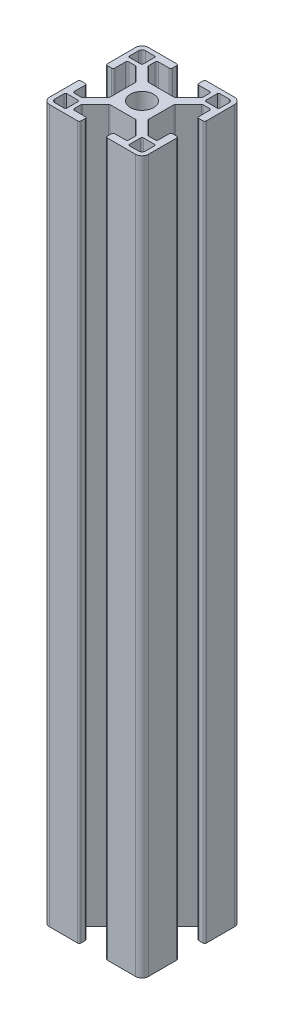
from build123d import *

# Parameters (mm, degrees)
SKETCH1_R           = 3.52998588
BOSS_EXTRUDE1_DEPTH = 107.95


with BuildPart() as part:
    # Sketch1 → Boss-Extrude1 (new, symmetric)
    with BuildSketch(Plane(origin=(0, 0, 0), x_dir=(1, 0, 0), z_dir=(0, 1, 0))):
        with BuildLine():
            Line((14.49994, -4), (13.24247465, -4))
            ThreePointArc((13.24247465, -4), (12.88892126, -4.146446609), (12.74247465, -4.5))
            Line((12.74247465, -4.5), (12.74247465, -7.732519321))
            ThreePointArc((12.74247465, -7.732519321), (12.602449697, -8.097296796), (12.242781236, -8.249967))
            Line((12.242781236, -8.249967), (10.260188032, -8.249967))
            ThreePointArc((10.260188032, -8.249967), (10.068847082, -8.211906919), (9.906636056, -8.103520976))
            Line((9.906636056, -8.103520976), (5.981117769, -4.178002689))
            ThreePointArc((5.981117769, -4.178002689), (5.872731827, -4.015791664), (5.834671745, -3.824450713))
            Line((5.834671745, -3.824450713), (5.834671745, -1.01249595))
            Line((5.834671745, -1.01249595), (5.834671745, 0.88749645))
            Line((5.834671745, 0.88749645), (5.834671745, 3.824450713))
            ThreePointArc((5.834671745, 3.824450713), (5.872731827, 4.015791664), (5.981117769, 4.178002689))
            Line((5.981117769, 4.178002689), (9.906636056, 8.103520976))
            ThreePointArc((9.906636056, 8.103520976), (10.068847082, 8.211906919), (10.260188032, 8.249967))
            Line((10.260188032, 8.249967), (12.242781236, 8.249967))
            ThreePointArc((12.242781236, 8.249967), (12.602449697, 8.097296796), (12.74247465, 7.732519321))
            Line((12.74247465, 7.732519321), (12.74247465, 4.5))
            ThreePointArc((12.74247465, 4.5), (12.88892126, 4.146446609), (13.24247465, 4))
            Line((13.24247465, 4), (14.49994, 4))
            ThreePointArc((14.49994, 4), (14.853493391, 4.146446609), (14.99994, 4.5))
            Line((14.99994, 4.5), (14.99994, 12.999948))
            ThreePointArc((14.99994, 12.999948), (14.414155906, 14.414155906), (12.999948, 14.99994))
            Line((12.999948, 14.99994), (4.5, 14.99994))
            ThreePointArc((4.5, 14.99994), (4.146446609, 14.853493391), (4, 14.49994))
            Line((4, 14.49994), (4, 13.24247465))
            ThreePointArc((4, 13.24247465), (4.146446609, 12.88892126), (4.5, 12.74247465))
            Line((4.5, 12.74247465), (7.732519321, 12.74247465))
            ThreePointArc((7.732519321, 12.74247465), (8.097296796, 12.602449697), (8.249967, 12.242781236))
            Line((8.249967, 12.242781236), (8.249967, 10.260188032))
            ThreePointArc((8.249967, 10.260188032), (8.211906919, 10.068847082), (8.103520976, 9.906636056))
            Line((8.103520976, 9.906636056), (4.178002689, 5.981117769))
            ThreePointArc((4.178002689, 5.981117769), (4.015791664, 5.872731827), (3.824450713, 5.834671745))
            Line((3.824450713, 5.834671745), (0.9499962, 5.834671745))
            Line((0.9499962, 5.834671745), (-0.9499962, 5.834671745))
            Line((-0.9499962, 5.834671745), (-3.824450713, 5.834671745))
            ThreePointArc((-3.824450713, 5.834671745), (-4.015791664, 5.872731827), (-4.178002689, 5.981117769))
            Line((-4.178002689, 5.981117769), (-8.103520976, 9.906636056))
            ThreePointArc((-8.103520976, 9.906636056), (-8.211906919, 10.068847082), (-8.249967, 10.260188032))
            Line((-8.249967, 10.260188032), (-8.249967, 12.242781236))
            ThreePointArc((-8.249967, 12.242781236), (-8.097296796, 12.602449697), (-7.732519321, 12.74247465))
            Line((-7.732519321, 12.74247465), (-4.5, 12.74247465))
            ThreePointArc((-4.5, 12.74247465), (-4.146446609, 12.88892126), (-4, 13.24247465))
            Line((-4, 13.24247465), (-4, 14.49994))
            ThreePointArc((-4, 14.49994), (-4.146446609, 14.853493391), (-4.5, 14.99994))
            Line((-4.5, 14.99994), (-12.999948, 14.99994))
            ThreePointArc((-12.999948, 14.99994), (-14.414155906, 14.414155906), (-14.99994, 12.999948))
            Line((-14.99994, 12.999948), (-14.99994, 4.5))
            ThreePointArc((-14.99994, 4.5), (-14.853493391, 4.146446609), (-14.49994, 4))
            Line((-14.49994, 4), (-13.24247465, 4))
            ThreePointArc((-13.24247465, 4), (-12.88892126, 4.146446609), (-12.74247465, 4.5))
            Line((-12.74247465, 4.5), (-12.74247465, 7.732519321))
            ThreePointArc((-12.74247465, 7.732519321), (-12.602449697, 8.097296796), (-12.242781236, 8.249967))
            Line((-12.242781236, 8.249967), (-10.260188032, 8.249967))
            ThreePointArc((-10.260188032, 8.249967), (-10.068847082, 8.211906919), (-9.906636056, 8.103520976))
            Line((-9.906636056, 8.103520976), (-5.981117769, 4.178002689))
            ThreePointArc((-5.981117769, 4.178002689), (-5.872731827, 4.015791664), (-5.834671745, 3.824450713))
            Line((-5.834671745, 3.824450713), (-5.834671745, 0.88749645))
            Line((-5.834671745, 0.88749645), (-5.834671745, -1.01249595))
            Line((-5.834671745, -1.01249595), (-5.834671745, -3.824450713))
            ThreePointArc((-5.834671745, -3.824450713), (-5.872731827, -4.015791664), (-5.981117769, -4.178002689))
            Line((-5.981117769, -4.178002689), (-9.906636056, -8.103520976))
            ThreePointArc((-9.906636056, -8.103520976), (-10.068847082, -8.211906919), (-10.260188032, -8.249967))
            Line((-10.260188032, -8.249967), (-12.242781236, -8.249967))
            ThreePointArc((-12.242781236, -8.249967), (-12.602449697, -8.097296796), (-12.74247465, -7.732519321))
            Line((-12.74247465, -7.732519321), (-12.74247465, -4.5))
            ThreePointArc((-12.74247465, -4.5), (-12.88892126, -4.146446609), (-13.24247465, -4))
            Line((-13.24247465, -4), (-14.49994, -4))
            ThreePointArc((-14.49994, -4), (-14.853493391, -4.146446609), (-14.99994, -4.5))
            Line((-14.99994, -4.5), (-14.99994, -12.999948))
            ThreePointArc((-14.99994, -12.999948), (-14.414155906, -14.414155906), (-12.999948, -14.99994))
            Line((-12.999948, -14.99994), (-4.5, -14.99994))
            ThreePointArc((-4.5, -14.99994), (-4.146446609, -14.853493391), (-4, -14.49994))
            Line((-4, -14.49994), (-4, -13.24247465))
            ThreePointArc((-4, -13.24247465), (-4.146446609, -12.88892126), (-4.5, -12.74247465))
            Line((-4.5, -12.74247465), (-7.732519321, -12.74247465))
            ThreePointArc((-7.732519321, -12.74247465), (-8.097296796, -12.602449697), (-8.249967, -12.242781236))
            Line((-8.249967, -12.242781236), (-8.249967, -10.260188032))
            ThreePointArc((-8.249967, -10.260188032), (-8.211906919, -10.068847082), (-8.103520976, -9.906636056))
            Line((-8.103520976, -9.906636056), (-4.178002689, -5.981117769))
            ThreePointArc((-4.178002689, -5.981117769), (-4.015791664, -5.872731827), (-3.824450713, -5.834671745))
            Line((-3.824450713, -5.834671745), (-0.9499962, -5.834671745))
            Line((-0.9499962, -5.834671745), (0.9499962, -5.834671745))
            Line((0.9499962, -5.834671745), (3.824450713, -5.834671745))
            ThreePointArc((3.824450713, -5.834671745), (4.015791664, -5.872731827), (4.178002689, -5.981117769))
            Line((4.178002689, -5.981117769), (8.103520976, -9.906636056))
            ThreePointArc((8.103520976, -9.906636056), (8.211906919, -10.068847082), (8.249967, -10.260188032))
            Line((8.249967, -10.260188032), (8.249967, -12.242781236))
            ThreePointArc((8.249967, -12.242781236), (8.097296796, -12.602449697), (7.732519321, -12.74247465))
            Line((7.732519321, -12.74247465), (4.5, -12.74247465))
            ThreePointArc((4.5, -12.74247465), (4.146446609, -12.88892126), (4, -13.24247465))
            Line((4, -13.24247465), (4, -14.49994))
            ThreePointArc((4, -14.49994), (4.146446609, -14.853493391), (4.5, -14.99994))
            Line((4.5, -14.99994), (12.999948, -14.99994))
            ThreePointArc((12.999948, -14.99994), (14.414155906, -14.414155906), (14.99994, -12.999948))
            Line((14.99994, -12.999948), (14.99994, -4.5))
            ThreePointArc((14.99994, -4.5), (14.853493391, -4.146446609), (14.49994, -4))
        make_face()
        with Locations(Location((0, 0, 0), (0, 0, 270))):
            Circle(SKETCH1_R, mode=Mode.SUBTRACT)
        with BuildLine():
            Line((-12.6999492, -13.6999452), (-9.880960476, -13.6999452))
            ThreePointArc((-9.880960476, -13.6999452), (-9.61155387, -13.58835333), (-9.499962, -13.318946724))
            Line((-9.499962, -13.318946724), (-9.499962, -9.87996048))
            ThreePointArc((-9.499962, -9.87996048), (-9.611260978, -9.611260978), (-9.87996048, -9.499962))
            Line((-9.87996048, -9.499962), (-13.318946724, -9.499962))
            ThreePointArc((-13.318946724, -9.499962), (-13.58835333, -9.61155387), (-13.6999452, -9.880960476))
            Line((-13.6999452, -9.880960476), (-13.6999452, -12.6999492))
            ThreePointArc((-13.6999452, -12.6999492), (-13.407053153, -13.407053153), (-12.6999492, -13.6999452))
        make_face(mode=Mode.SUBTRACT)
        with BuildLine():
            Line((13.6999452, -12.6999492), (13.6999452, -9.880960476))
            ThreePointArc((13.6999452, -9.880960476), (13.58835333, -9.61155387), (13.318946724, -9.499962))
            Line((13.318946724, -9.499962), (9.87996048, -9.499962))
            ThreePointArc((9.87996048, -9.499962), (9.611260978, -9.611260978), (9.499962, -9.87996048))
            Line((9.499962, -9.87996048), (9.499962, -13.318946724))
            ThreePointArc((9.499962, -13.318946724), (9.61155387, -13.58835333), (9.880960476, -13.6999452))
            Line((9.880960476, -13.6999452), (12.6999492, -13.6999452))
            ThreePointArc((12.6999492, -13.6999452), (13.407053153, -13.407053153), (13.6999452, -12.6999492))
        make_face(mode=Mode.SUBTRACT)
        with BuildLine():
            Line((9.87996048, 9.499962), (13.318946724, 9.499962))
            ThreePointArc((13.318946724, 9.499962), (13.58835333, 9.61155387), (13.6999452, 9.880960476))
            Line((13.6999452, 9.880960476), (13.6999452, 12.6999492))
            ThreePointArc((13.6999452, 12.6999492), (13.407053153, 13.407053153), (12.6999492, 13.6999452))
            Line((12.6999492, 13.6999452), (9.880960476, 13.6999452))
            ThreePointArc((9.880960476, 13.6999452), (9.61155387, 13.58835333), (9.499962, 13.318946724))
            Line((9.499962, 13.318946724), (9.499962, 9.87996048))
            ThreePointArc((9.499962, 9.87996048), (9.611260978, 9.611260978), (9.87996048, 9.499962))
        make_face(mode=Mode.SUBTRACT)
        with BuildLine():
            Line((-13.6999452, 12.6999492), (-13.6999452, 9.880960476))
            ThreePointArc((-13.6999452, 9.880960476), (-13.58835333, 9.61155387), (-13.318946724, 9.499962))
            Line((-13.318946724, 9.499962), (-9.87996048, 9.499962))
            ThreePointArc((-9.87996048, 9.499962), (-9.611260978, 9.611260978), (-9.499962, 9.87996048))
            Line((-9.499962, 9.87996048), (-9.499962, 13.318946724))
            ThreePointArc((-9.499962, 13.318946724), (-9.61155387, 13.58835333), (-9.880960476, 13.6999452))
            Line((-9.880960476, 13.6999452), (-12.6999492, 13.6999452))
            ThreePointArc((-12.6999492, 13.6999452), (-13.407053153, 13.407053153), (-13.6999452, 12.6999492))
        make_face(mode=Mode.SUBTRACT)
    extrude(amount=BOSS_EXTRUDE1_DEPTH, both=True)


solid = part.part
